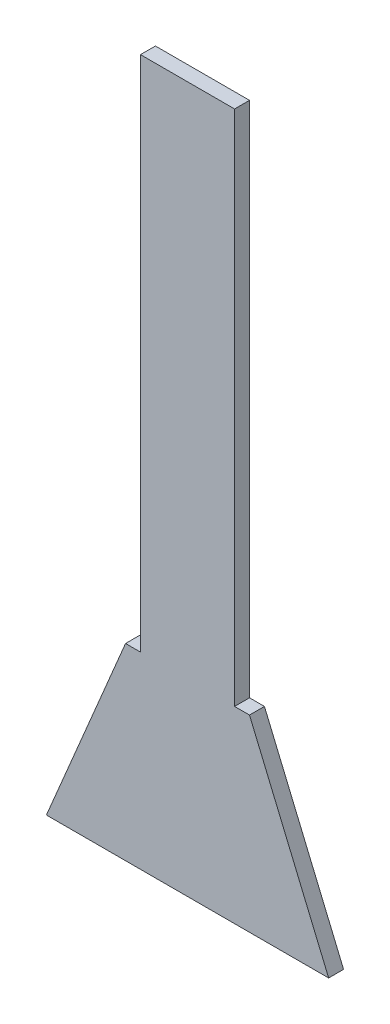
from build123d import *

# Parameters (mm, degrees)
BOSS_EXTRU_1_DEPTH = 6.35


with BuildPart() as part:
    # Esquisse1 → Boss.-Extru.1 (new body)
    with BuildSketch(Plane.XY):
        Polygon((-20, 300), (20, 300), (20, 80), (26.35, 80), (60, 0), (-60, 0), (-26.35, 80), (-20, 80), align=None)
    extrude(amount=BOSS_EXTRU_1_DEPTH)


solid = part.part
